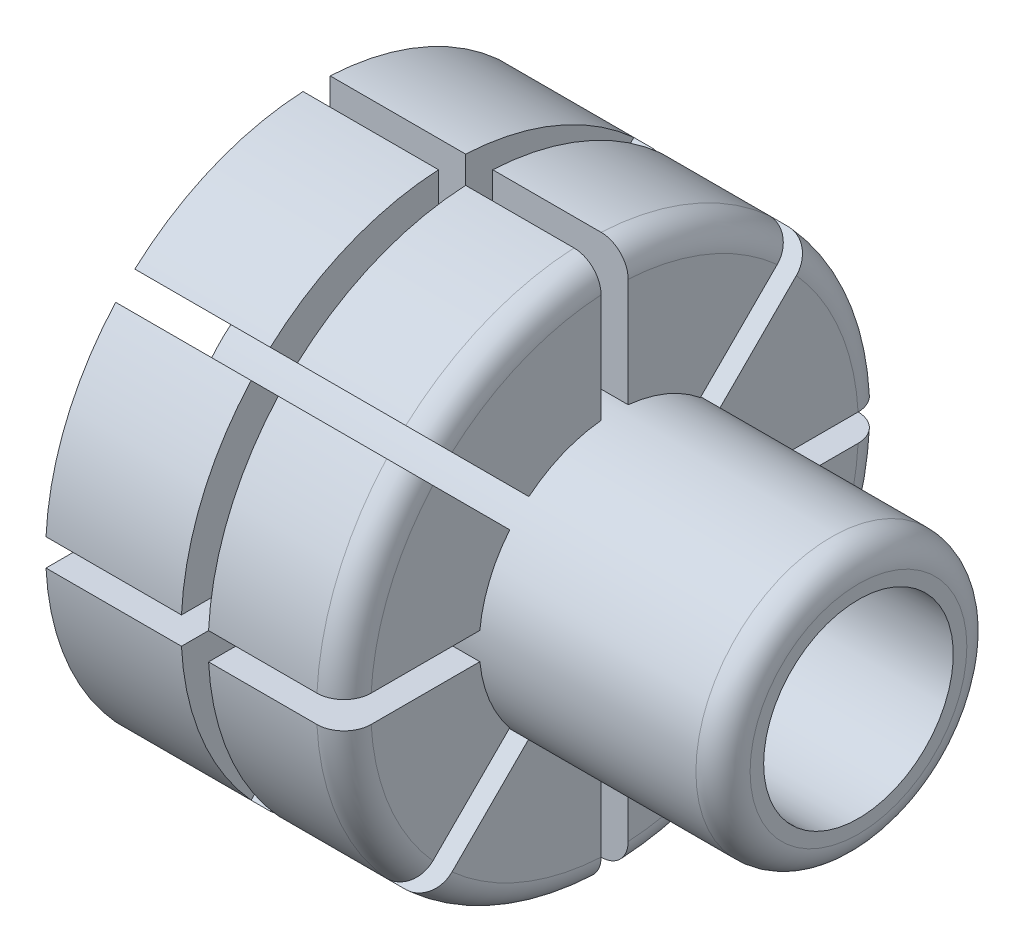
from build123d import *

# Parameters (mm, degrees)
TAGLIO_ESTRUSIONE1_DEPTH    = 25.494897427831784
RIPETIZIONECIRCOLARE1_COUNT = 8


with BuildPart() as part:
    # Schizzo1 → Rivoluzione1 (revolve)
    with BuildSketch(Plane.XY):
        with BuildLine():
            Line((-18.60104822335024, 10), (-23.60104822335024, 10.000000000000002))
            Line((-23.60104822335024, 10.000000000000002), (-23.60104822335024, 3.5))
            Line((-23.60104822335024, 3.5), (-3.60104822335024, 3.5))
            Line((-3.60104822335024, 3.5), (-3.6010482233502397, 3.9999999999999925))
            ThreePointArc((-3.6010482233502397, 3.9999999999999925), (-3.893941442163692, 4.707106781186547), (-4.601048223350247, 5))
            Line((-4.601048223350247, 5), (-12.601048223350238, 4.999999999999999))
            Line((-12.601048223350238, 4.999999999999999), (-12.601048223350238, 8.999999999999993))
            ThreePointArc((-12.601048223350238, 8.999999999999993), (-12.89394144216369, 9.707106781186548), (-13.601048223350245, 10))
            Line((-13.601048223350245, 10), (-17.60104822335024, 10))
            Line((-17.60104822335024, 10), (-17.60104822335024, 6))
            Line((-17.60104822335024, 6), (-18.60104822335024, 6))
            Line((-18.60104822335024, 6), (-18.60104822335024, 10))
        make_face()
    revolve(axis=Axis((-39.30950846023687, 0, 0), (1, 0, 0)))

    # Schizzo2 → Taglio-Estrusione1 (cut, through all)
    with BuildSketch(Plane.ZY.offset(23.60104822335024)):
        with BuildLine():
            Line((0.5, 4.974937185533099), (0.5, 10.752749152388752))
            Line((0.5, 10.752749152388752), (-0.5, 10.752749152388752))
            Line((-0.5, 10.752749152388752), (-0.5, 4.974937185533099))
            ThreePointArc((-0.5, 4.974937185533099), (3.1e-16, 4.999999999999999), (0.5, 4.974937185533099))
        make_face()
    taglio_estrusione1 = extrude(amount=-TAGLIO_ESTRUSIONE1_DEPTH, mode=Mode.SUBTRACT)

    # RipetizioneCircolare1: Taglio-Estrusione1 ×8 about axis
    ripetizionecircolare1_axis = Axis((-39.30950846023687, 0, 0), (-1, 0, 0))
    for i in range(1, RIPETIZIONECIRCOLARE1_COUNT):
        add(taglio_estrusione1.rotate(ripetizionecircolare1_axis, i * 360 / RIPETIZIONECIRCOLARE1_COUNT), mode=Mode.SUBTRACT)


solid = part.part
